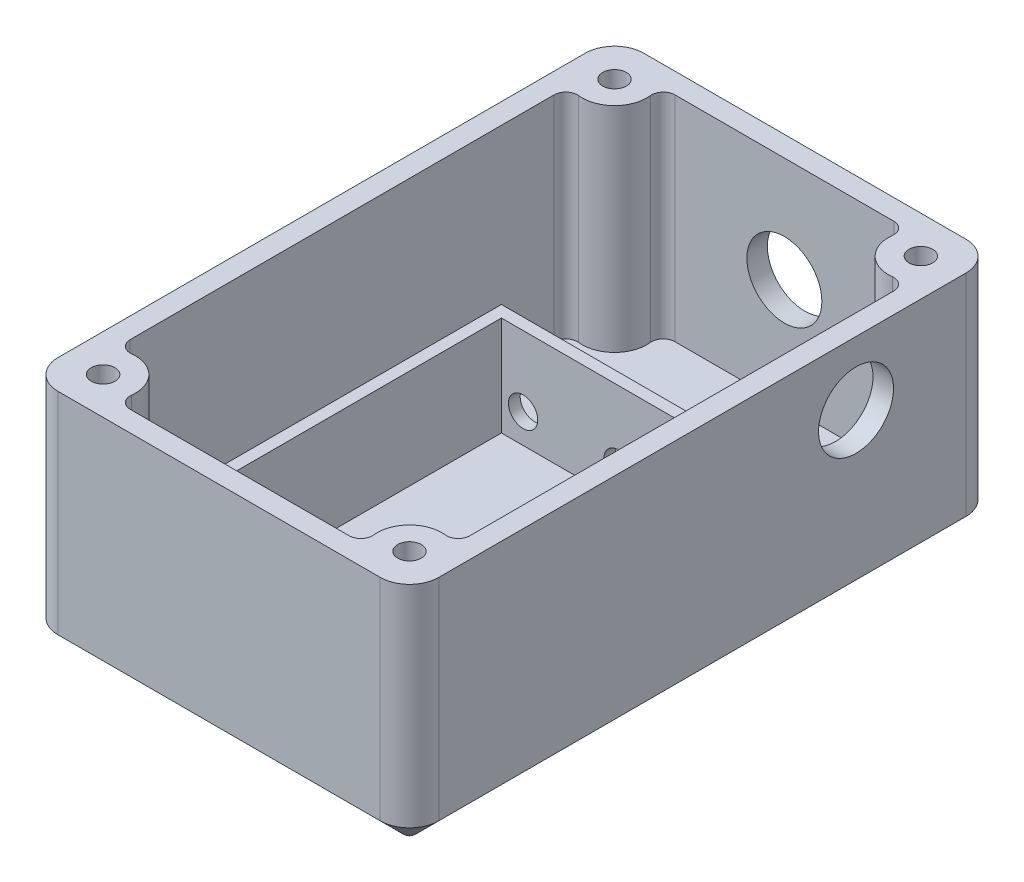
from build123d import *

# Parameters (mm, degrees)
SKETCH3_W                   = 65
SKETCH3_H                   = 100
BOSS_EXTRUDE1_DEPTH         = 40
F_21_0_159_DIAMETER_HOLE1_D = 4.0386
SHELL1_T                    = -3.5
FILLET1_R                   = 2
SKETCH14_W                  = 13
SKETCH14_H                  = 7
CUT_EXTRUDE1_DEPTH          = 10
FILLET2_R                   = 5
CHAMFER2_SIZE               = 4
SKETCH15_R                  = 6.4
CUT_EXTRUDE3_DEPTH          = 10
SKETCH17_R                  = 6.4
CUT_EXTRUDE6_DEPTH          = 10
CUT_EXTRUDE8_DEPTH          = 1.5
SKETCH20_W                  = 51
SKETCH20_H                  = 53
BOSS_EXTRUDE3_DEPTH         = 17
SKETCH22_W                  = 49
SKETCH22_H                  = 49
CUT_EXTRUDE9_DEPTH          = 17
SKETCH23_R                  = 2.5
CUT_EXTRUDE10_DEPTH         = 3


with BuildPart() as part:
    # Sketch3 → Boss-Extrude1 (new body)
    with BuildSketch(Plane(origin=(0, 0, 0), x_dir=(1, 0, 0), z_dir=(0, 1, 0))):
        Rectangle(SKETCH3_W, SKETCH3_H)
    extrude(amount=BOSS_EXTRUDE1_DEPTH)

    # #21 (0.159) Diameter Hole1 (through all)
    with Locations(Plane(origin=(0, 40, 0), x_dir=(1, 0, 0), z_dir=(0, 1, 0))):
        with Locations((-26.15, 43.65), (26.15, 43.65), (26.15, -43.65), (-26.15, -43.65)):
            Hole(F_21_0_159_DIAMETER_HOLE1_D / 2)

    # Shell1
    shell1_openings = [part.faces().sort_by_distance(p)[0] for p in [
        (0, 40, 0),
    ]]
    offset(amount=SHELL1_T, openings=shell1_openings, kind=Kind.INTERSECTION)

    # Fillet1
    fillet1_edges = [part.edges().sort_by_distance(p)[0] for p in [
        (29, 21.75, 38.923460834),
        (21.423460834, 21.75, -46.5),
        (-29, 21.75, -38.923460834),
        (-21.423460834, 21.75, 46.5),
        (-29, 21.75, 38.923460834),
        (21.423460834, 21.75, 46.5),
        (29, 21.75, -38.923460834),
        (-21.423460834, 21.75, -46.5),
    ]]
    fillet(fillet1_edges, radius=FILLET1_R)

    # Sketch14 → Cut-Extrude1 (cut)
    with BuildSketch(Plane(origin=(0, 0, 0), x_dir=(1, 0, 0), z_dir=(0, 1, 0))):
        with Locations((-8.88380044, -40.5)):
            Rectangle(SKETCH14_W, SKETCH14_H)
        with Locations((9.11619956, -40.5)):
            Rectangle(SKETCH14_W, SKETCH14_H)
        with Locations((-8.88380044, 26.688454416)):
            Rectangle(SKETCH14_W, SKETCH14_H)
        with Locations((9.11619956, 26.688454416)):
            Rectangle(SKETCH14_W, SKETCH14_H)
    extrude(amount=CUT_EXTRUDE1_DEPTH, mode=Mode.SUBTRACT)

    # Fillet2
    fillet2_edges = [part.edges().sort_by_distance(p)[0] for p in [
        (32.5, 20, 50),
        (-32.5, 20, 50),
        (-32.5, 20, -50),
        (32.5, 20, -50),
    ]]
    fillet(fillet2_edges, radius=FILLET2_R)

    # Chamfer2
    chamfer2_edges = [part.edges().sort_by_distance(p)[0] for p in [
        (-31.035533906, 0, -48.535533906),
        (-31.035533906, 0, 48.535533906),
        (31.035533906, 0, -48.535533906),
        (31.035533906, 0, 48.535533906),
        (32.5, 0, 0),
    ]]
    chamfer(chamfer2_edges, length=CHAMFER2_SIZE)

    # Sketch15 → Cut-Extrude3 (cut)
    with BuildSketch(Plane(origin=(0, 0, -50), x_dir=(-1, 0, 0), z_dir=(0, 0, -1))):
        with Locations((0, 22)):
            Circle(SKETCH15_R)
    extrude(amount=-CUT_EXTRUDE3_DEPTH, mode=Mode.SUBTRACT)

    # Sketch17 → Cut-Extrude6 (cut)
    with BuildSketch(Plane(origin=(32.5, 0, 0), x_dir=(0, 0, -1), z_dir=(1, 0, 0))):
        with Locations((26.233387705, 29.113582019)):
            Circle(SKETCH17_R)
    extrude(amount=-CUT_EXTRUDE6_DEPTH, mode=Mode.SUBTRACT)

    # Sketch18 → Cut-Extrude8 (cut)
    with BuildSketch(Plane(origin=(0, 3.5, 0), x_dir=(1, 0, 0), z_dir=(0, 1, 0))):
        with BuildLine():
            Line((2.962903006, 35.660547198), (3, 35.660547198))
            Line((3, 35.660547198), (3, 31.660547198))
            Line((3, 31.660547198), (-3, 31.660547198))
            Line((-3, 31.660547198), (-3, 35.660547198))
            Line((-3, 35.660547198), (-2.962903006, 35.660547198))
            ThreePointArc((-2.962903006, 35.660547198), (0, 46.338397214), (2.962903006, 35.660547198))
        make_face()
    extrude(amount=-CUT_EXTRUDE8_DEPTH, mode=Mode.SUBTRACT)

    # Sketch20 → Boss-Extrude3 (add)
    with BuildSketch(Plane(origin=(0, 3.5, 0), x_dir=(1, 0, 0), z_dir=(0, 1, 0))):
        with Locations((3.5, -6.305895328)):
            Rectangle(SKETCH20_W, SKETCH20_H)
    extrude(amount=BOSS_EXTRUDE3_DEPTH)

    # Sketch22 → Cut-Extrude9 (cut)
    with BuildSketch(Plane(origin=(0, 20.5, 0), x_dir=(1, 0, 0), z_dir=(0, 1, 0))):
        with Locations((4.5, -6.305895328)):
            Rectangle(SKETCH22_W, SKETCH22_H)
    extrude(amount=-CUT_EXTRUDE9_DEPTH, mode=Mode.SUBTRACT)

    # Sketch23 → Cut-Extrude10 (cut)
    with BuildSketch(Plane.XY.offset(-18.194104672)):
        with Locations((-16.3, 8.5)):
            Circle(SKETCH23_R)
        with Locations((0, 8.5)):
            Circle(SKETCH23_R)
        with Locations((16.3, 8.5)):
            Circle(SKETCH23_R)
    extrude(amount=-CUT_EXTRUDE10_DEPTH, mode=Mode.SUBTRACT)


solid = part.part
